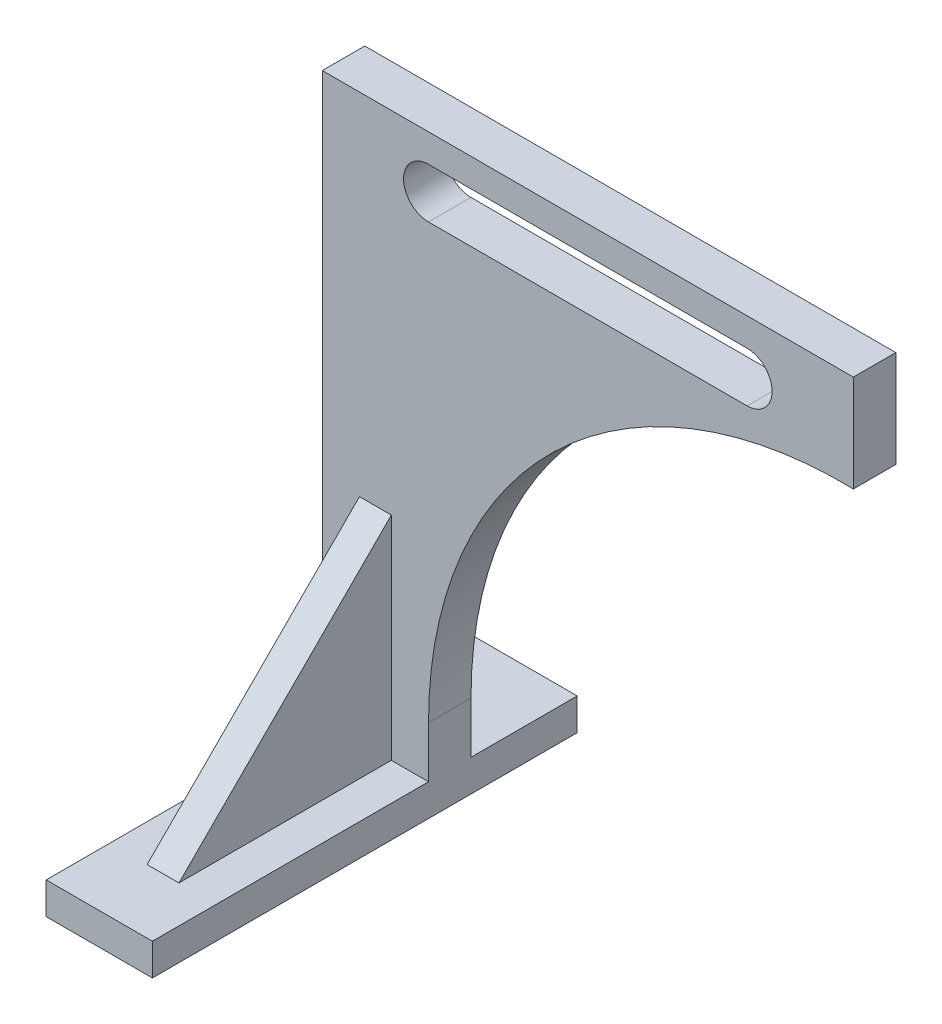
from build123d import *

# Parameters (mm, degrees)
BOSS_EXTRUDE1_DEPTH = 20
CUT_EXTRUDE1_DEPTH  = 80
SKETCH3_W           = 15
SKETCH3_H           = 100
BOSS_EXTRUDE2_DEPTH = 100
SKETCH10_W          = 50
SKETCH10_H          = 200
BOSS_EXTRUDE4_DEPTH = 15
CUT_EXTRUDE3_DEPTH  = 166


with BuildPart() as part:
    # Sketch1 → Boss-Extrude1 (new body)
    with BuildSketch(Plane.XY):
        with BuildLine():
            Line((-75, -132.5), (-125, -132.5))
            Line((-125, -132.5), (-125, 132.5))
            Line((-125, 132.5), (125, 132.5))
            Line((125, 132.5), (125, 86.875222581))
            ThreePointArc((125, 86.875222581), (-16.12613386, 31.381561178), (-75, -108.368215209))
            Line((-75, -108.368215209), (-75, -132.5))
        make_face()
    extrude(amount=-BOSS_EXTRUDE1_DEPTH)

    # Sketch2 → Cut-Extrude1 (cut)
    with BuildSketch(Plane.XY):
        with BuildLine():
            Line((-75, 119.25), (75, 119.25))
            ThreePointArc((75, 119.25), (86.75, 107.5), (75, 95.75))
            Line((75, 95.75), (-75, 95.75))
            ThreePointArc((-75, 95.75), (-86.75, 107.5), (-75, 119.25))
        make_face()
    extrude(amount=-CUT_EXTRUDE1_DEPTH, mode=Mode.SUBTRACT)

    # Sketch3 → Boss-Extrude2 (add)
    with BuildSketch(Plane.XY):
        with Locations((-100, -82.5)):
            Rectangle(SKETCH3_W, SKETCH3_H)
    extrude(amount=BOSS_EXTRUDE2_DEPTH)

    # Sketch10 → Boss-Extrude4 (add)
    with BuildSketch(Plane.XZ.offset(132.5)):
        with Locations((-100, 30)):
            Rectangle(SKETCH10_W, SKETCH10_H)
    extrude(amount=BOSS_EXTRUDE4_DEPTH)

    # Sketch11 → Cut-Extrude3 (cut)
    with BuildSketch(Plane(origin=(-92.5, 0, 0), x_dir=(0, 0, -1), z_dir=(1, 0, 0))):
        Polygon((0, -32.5), (-100, -132.5), (-100, -32.5), align=None)
    extrude(amount=-CUT_EXTRUDE3_DEPTH, mode=Mode.SUBTRACT)


solid = part.part
